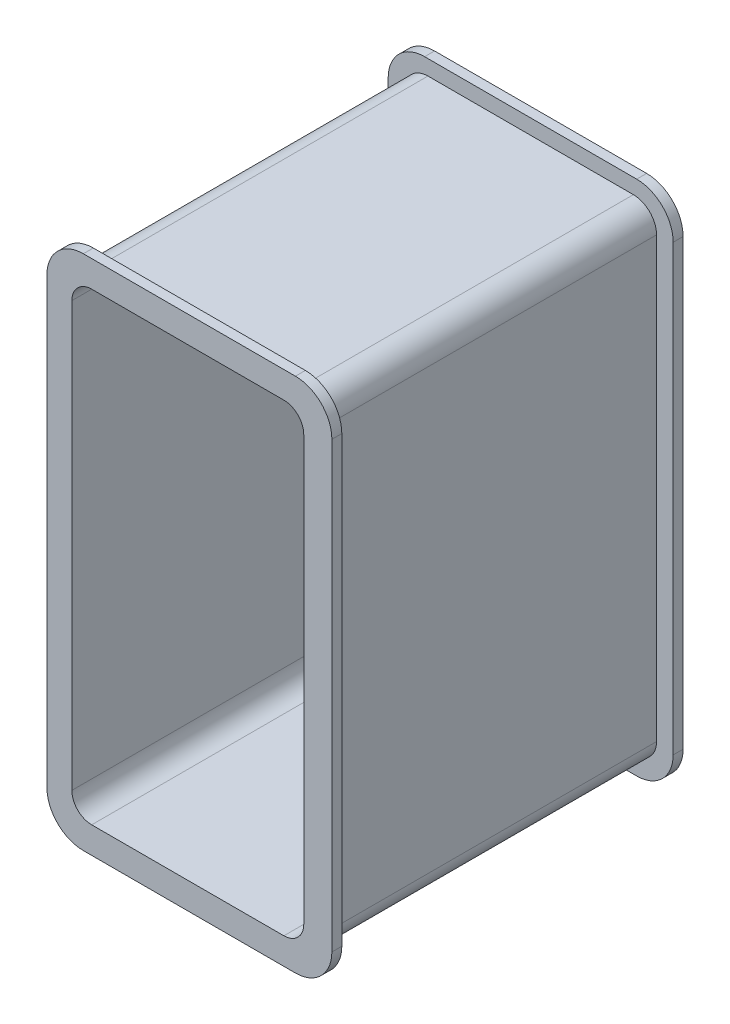
from build123d import *

# Parameters (mm, degrees)
BOSS_EXTRUDE3_DEPTH = 100
BOSS_EXTRUDE4_DEPTH = 3
BOSS_EXTRUDE5_DEPTH = 3


with BuildPart() as part:
    # Sketch1 → Boss-Extrude3 (new body)
    with BuildSketch(Plane(origin=(0, 0, 0), x_dir=(0, 1, 0), z_dir=(0, 0, 1))):
        with BuildLine():
            Line((7, 0), (139.441461344, 0))
            ThreePointArc((139.441461344, 0), (144.391208812, 2.050252532), (146.441461344, 7))
            Line((146.441461344, 7), (146.441461344, 69))
            ThreePointArc((146.441461344, 69), (144.391208812, 73.949747468), (139.441461344, 76))
            Line((139.441461344, 76), (7, 76))
            ThreePointArc((7, 76), (2.050252532, 73.949747468), (0, 69))
            Line((0, 69), (0, 7))
            ThreePointArc((0, 7), (2.050252532, 2.050252532), (7, 0))
        make_face()
        with BuildLine():
            Line((3, 38), (3, 67.481223709))
            ThreePointArc((3, 67.481223709), (4.757359313, 71.723864396), (9, 73.481223709))
            Line((9, 73.481223709), (137, 73.481223709))
            ThreePointArc((137, 73.481223709), (141.242640687, 71.723864396), (143, 67.481223709))
            Line((143, 67.481223709), (143, 9.481223709))
            ThreePointArc((143, 9.481223709), (141.242640687, 5.238583022), (137, 3.481223709))
            Line((137, 3.481223709), (9, 3.481223709))
            ThreePointArc((9, 3.481223709), (4.757359313, 5.238583022), (3, 9.481223709))
            Line((3, 9.481223709), (3, 38))
        make_face(mode=Mode.SUBTRACT)
    extrude(amount=BOSS_EXTRUDE3_DEPTH)

    # Sketch1<5> → Boss-Extrude4 (add)
    with BuildSketch(Plane(origin=(0, 0, 0), x_dir=(0, 1, 0), z_dir=(0, 0, 1))):
        with BuildLine():
            Line((151, 38), (151, 6))
            ThreePointArc((151, 6), (147.778174593, -1.778174593), (140, -5))
            Line((140, -5), (6, -5))
            ThreePointArc((6, -5), (-1.778174593, -1.778174593), (-5, 6))
            Line((-5, 6), (-5, 70))
            ThreePointArc((-5, 70), (-1.778174593, 77.778174593), (6, 81))
            Line((6, 81), (73.220730672, 81))
            Line((73.220730672, 81), (140, 81))
            ThreePointArc((140, 81), (147.778174593, 77.778174593), (151, 70))
            Line((151, 70), (151, 38))
        make_face()
    extrude(amount=-BOSS_EXTRUDE4_DEPTH)

    # Sketch2 → Boss-Extrude5 (add)
    with BuildSketch(Plane.XY.offset(100)):
        with BuildLine():
            Line((-70, 151), (-6, 151))
            ThreePointArc((-6, 151), (1.778174593, 147.778174593), (5, 140))
            Line((5, 140), (5, 6))
            ThreePointArc((5, 6), (1.778174593, -1.778174593), (-6, -5))
            Line((-6, -5), (-70, -5))
            ThreePointArc((-70, -5), (-77.778174593, -1.778174593), (-81, 6))
            Line((-81, 6), (-81, 140))
            ThreePointArc((-81, 140), (-77.778174593, 147.778174593), (-70, 151))
        make_face()
        with BuildLine():
            Line((-67.481223709, 143), (-9.481223709, 143))
            ThreePointArc((-9.481223709, 143), (-5.238583022, 141.242640687), (-3.481223709, 137))
            Line((-3.481223709, 137), (-3.481223709, 9))
            ThreePointArc((-3.481223709, 9), (-5.238583022, 4.757359313), (-9.481223709, 3))
            Line((-9.481223709, 3), (-67.481223709, 3))
            ThreePointArc((-67.481223709, 3), (-71.723864396, 4.757359313), (-73.481223709, 9))
            Line((-73.481223709, 9), (-73.481223709, 137))
            ThreePointArc((-73.481223709, 137), (-71.723864396, 141.242640687), (-67.481223709, 143))
        make_face(mode=Mode.SUBTRACT)
    extrude(amount=BOSS_EXTRUDE5_DEPTH)


solid = part.part
